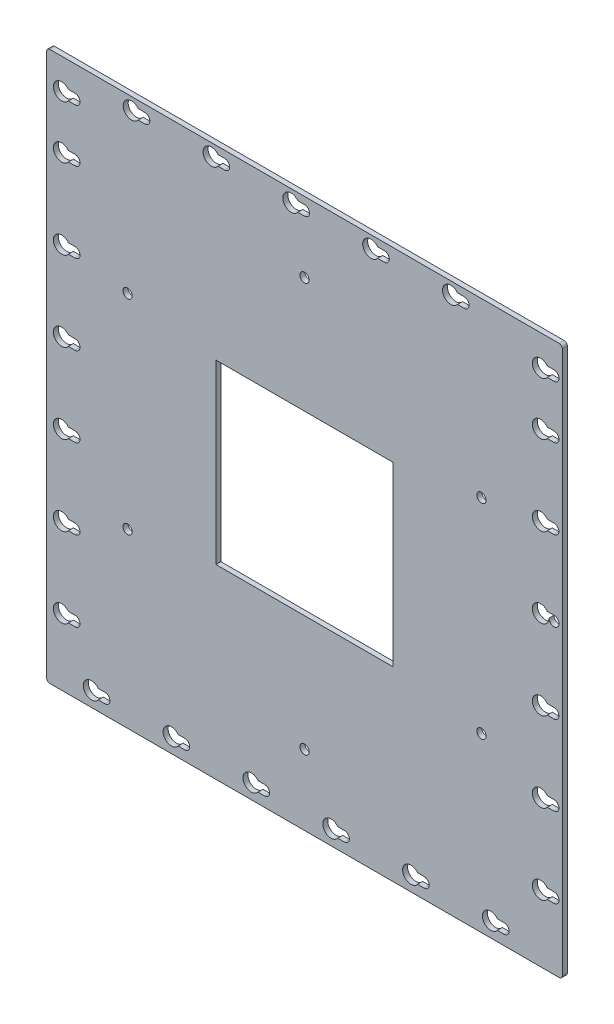
from build123d import *

# Parameters (mm, degrees)
SKETCH1_W           = 164.1
SKETCH1_H           = 174.745
SKETCH1_R           = 1.4732
SKETCH1_W_2         = 56.35
SKETCH1_H_2         = 56.35
BOSS_EXTRUDE1_DEPTH = 1.5875
FILLET1_R           = 1


with BuildPart() as part:
    # Sketch1 → Boss-Extrude1 (new body)
    with BuildSketch(Plane.XY):
        with Locations((82.55, -87.3725)):
            Rectangle(SKETCH1_W, SKETCH1_H)
        with Locations((82.55, -152.3725)):
            Circle(SKETCH1_R, mode=Mode.SUBTRACT)
        with Locations((82.55, -87.3725)):
            Rectangle(SKETCH1_W_2, SKETCH1_H_2, mode=Mode.SUBTRACT)
        with Locations((82.55, -22.3725)):
            Circle(SKETCH1_R, mode=Mode.SUBTRACT)
        with BuildLine():
            Line((82.55, -5.4375), (80.434372699, -5.4375))
            ThreePointArc((80.434372699, -5.4375), (75.6625, -3.85), (80.434372699, -2.2625))
            Line((80.434372699, -2.2625), (82.55, -2.2625))
            ThreePointArc((82.55, -2.2625), (84.1375, -3.85), (82.55, -5.4375))
        make_face(mode=Mode.SUBTRACT)
        with BuildLine():
            Line((16.934372699, -168.395), (19.05, -168.395))
            ThreePointArc((19.05, -168.395), (20.6375, -169.9825), (19.05, -171.57))
            Line((19.05, -171.57), (16.934372699, -171.57))
            ThreePointArc((16.934372699, -171.57), (12.1625, -169.9825), (16.934372699, -168.395))
        make_face(mode=Mode.SUBTRACT)
        with BuildLine():
            Line((7.409372699, -151.9325), (9.525, -151.9325))
            ThreePointArc((9.525, -151.9325), (11.1125, -153.52), (9.525, -155.1075))
            Line((9.525, -155.1075), (7.409372699, -155.1075))
            ThreePointArc((7.409372699, -155.1075), (2.6375, -153.52), (7.409372699, -151.9325))
        make_face(mode=Mode.SUBTRACT)
        with BuildLine():
            Line((42.334372699, -168.395), (44.45, -168.395))
            ThreePointArc((44.45, -168.395), (46.0375, -169.9825), (44.45, -171.57))
            Line((44.45, -171.57), (42.334372699, -171.57))
            ThreePointArc((42.334372699, -171.57), (37.5625, -169.9825), (42.334372699, -168.395))
        make_face(mode=Mode.SUBTRACT)
        with BuildLine():
            Line((67.734372699, -168.395), (69.85, -168.395))
            ThreePointArc((69.85, -168.395), (71.4375, -169.9825), (69.85, -171.57))
            Line((69.85, -171.57), (67.734372699, -171.57))
            ThreePointArc((67.734372699, -171.57), (62.9625, -169.9825), (67.734372699, -168.395))
        make_face(mode=Mode.SUBTRACT)
        with BuildLine():
            Line((7.409372699, -126.5325), (9.525, -126.5325))
            ThreePointArc((9.525, -126.5325), (11.1125, -128.12), (9.525, -129.7075))
            Line((9.525, -129.7075), (7.409372699, -129.7075))
            ThreePointArc((7.409372699, -129.7075), (2.6375, -128.12), (7.409372699, -126.5325))
        make_face(mode=Mode.SUBTRACT)
        with Locations((26.258348754, -119.8725)):
            Circle(SKETCH1_R, mode=Mode.SUBTRACT)
        with BuildLine():
            Line((7.409372699, -101.1325), (9.525, -101.1325))
            ThreePointArc((9.525, -101.1325), (11.1125, -102.72), (9.525, -104.3075))
            Line((9.525, -104.3075), (7.409372699, -104.3075))
            ThreePointArc((7.409372699, -104.3075), (2.6375, -102.72), (7.409372699, -101.1325))
        make_face(mode=Mode.SUBTRACT)
        with BuildLine():
            Line((7.409372699, -75.7325), (9.525, -75.7325))
            ThreePointArc((9.525, -75.7325), (11.1125, -77.32), (9.525, -78.9075))
            Line((9.525, -78.9075), (7.409372699, -78.9075))
            ThreePointArc((7.409372699, -78.9075), (2.6375, -77.32), (7.409372699, -75.7325))
        make_face(mode=Mode.SUBTRACT)
        with BuildLine():
            Line((7.409372699, -50.3325), (9.525, -50.3325))
            ThreePointArc((9.525, -50.3325), (11.1125, -51.92), (9.525, -53.5075))
            Line((9.525, -53.5075), (7.409372699, -53.5075))
            ThreePointArc((7.409372699, -53.5075), (2.6375, -51.92), (7.409372699, -50.3325))
        make_face(mode=Mode.SUBTRACT)
        with Locations((26.258348754, -54.8725)):
            Circle(SKETCH1_R, mode=Mode.SUBTRACT)
        with BuildLine():
            Line((7.409372699, -24.9325), (9.525, -24.9325))
            ThreePointArc((9.525, -24.9325), (11.1125, -26.52), (9.525, -28.1075))
            Line((9.525, -28.1075), (7.409372699, -28.1075))
            ThreePointArc((7.409372699, -28.1075), (2.6375, -26.52), (7.409372699, -24.9325))
        make_face(mode=Mode.SUBTRACT)
        with BuildLine():
            Line((7.409372699, -8.1), (9.525, -8.1))
            ThreePointArc((9.525, -8.1), (11.1125, -9.6875), (9.525, -11.275))
            Line((9.525, -11.275), (7.409372699, -11.275))
            ThreePointArc((7.409372699, -11.275), (2.6375, -9.6875), (7.409372699, -8.1))
        make_face(mode=Mode.SUBTRACT)
        with BuildLine():
            Line((29.634372699, -2.2625), (31.75, -2.2625))
            ThreePointArc((31.75, -2.2625), (33.3375, -3.85), (31.75, -5.4375))
            Line((31.75, -5.4375), (29.634372699, -5.4375))
            ThreePointArc((29.634372699, -5.4375), (24.8625, -3.85), (29.634372699, -2.2625))
        make_face(mode=Mode.SUBTRACT)
        with BuildLine():
            Line((55.034372699, -2.2625), (57.15, -2.2625))
            ThreePointArc((57.15, -2.2625), (58.7375, -3.85), (57.15, -5.4375))
            Line((57.15, -5.4375), (55.034372699, -5.4375))
            ThreePointArc((55.034372699, -5.4375), (50.2625, -3.85), (55.034372699, -2.2625))
        make_face(mode=Mode.SUBTRACT)
        with BuildLine():
            ThreePointArc((161.925, -8.1), (163.5125, -9.6875), (161.925, -11.275))
            Line((161.925, -11.275), (159.809372699, -11.275))
            ThreePointArc((159.809372699, -11.275), (155.0375, -9.6875), (159.809372699, -8.1))
            Line((159.809372699, -8.1), (161.925, -8.1))
        make_face(mode=Mode.SUBTRACT)
        with BuildLine():
            Line((93.134372699, -168.395), (95.25, -168.395))
            ThreePointArc((95.25, -168.395), (96.8375, -169.9825), (95.25, -171.57))
            Line((95.25, -171.57), (93.134372699, -171.57))
            ThreePointArc((93.134372699, -171.57), (88.3625, -169.9825), (93.134372699, -168.395))
        make_face(mode=Mode.SUBTRACT)
        with BuildLine():
            Line((118.534372699, -168.395), (120.65, -168.395))
            ThreePointArc((120.65, -168.395), (122.2375, -169.9825), (120.65, -171.57))
            Line((120.65, -171.57), (118.534372699, -171.57))
            ThreePointArc((118.534372699, -171.57), (113.7625, -169.9825), (118.534372699, -168.395))
        make_face(mode=Mode.SUBTRACT)
        with BuildLine():
            Line((143.934372699, -168.395), (146.05, -168.395))
            ThreePointArc((146.05, -168.395), (147.6375, -169.9825), (146.05, -171.57))
            Line((146.05, -171.57), (143.934372699, -171.57))
            ThreePointArc((143.934372699, -171.57), (139.1625, -169.9825), (143.934372699, -168.395))
        make_face(mode=Mode.SUBTRACT)
        with BuildLine():
            Line((159.809372699, -151.9325), (161.925, -151.9325))
            ThreePointArc((161.925, -151.9325), (163.5125, -153.52), (161.925, -155.1075))
            Line((161.925, -155.1075), (159.809372699, -155.1075))
            ThreePointArc((159.809372699, -155.1075), (155.0375, -153.52), (159.809372699, -151.9325))
        make_face(mode=Mode.SUBTRACT)
        with Locations((138.841651246, -119.8725)):
            Circle(SKETCH1_R, mode=Mode.SUBTRACT)
        with BuildLine():
            Line((159.809372699, -126.5325), (161.925, -126.5325))
            ThreePointArc((161.925, -126.5325), (163.5125, -128.12), (161.925, -129.7075))
            Line((161.925, -129.7075), (159.809372699, -129.7075))
            ThreePointArc((159.809372699, -129.7075), (155.0375, -128.12), (159.809372699, -126.5325))
        make_face(mode=Mode.SUBTRACT)
        with BuildLine():
            Line((159.809372699, -101.1325), (161.925, -101.1325))
            ThreePointArc((161.925, -101.1325), (163.5125, -102.72), (161.925, -104.3075))
            Line((161.925, -104.3075), (159.809372699, -104.3075))
            ThreePointArc((159.809372699, -104.3075), (155.0375, -102.72), (159.809372699, -101.1325))
        make_face(mode=Mode.SUBTRACT)
        with BuildLine():
            Line((159.809372699, -75.7325), (161.925, -75.7325))
            ThreePointArc((161.925, -75.7325), (163.047532015, -78.442532015), (160.3375, -77.32))
            ThreePointArc((160.3375, -77.32), (155.172995809, -78.156521771), (159.809372699, -75.7325))
        make_face(mode=Mode.SUBTRACT)
        with Locations((138.841651246, -54.8725)):
            Circle(SKETCH1_R, mode=Mode.SUBTRACT)
        with BuildLine():
            Line((159.809372699, -50.3325), (161.925, -50.3325))
            ThreePointArc((161.925, -50.3325), (163.5125, -51.92), (161.925, -53.5075))
            Line((161.925, -53.5075), (159.809372699, -53.5075))
            ThreePointArc((159.809372699, -53.5075), (155.0375, -51.92), (159.809372699, -50.3325))
        make_face(mode=Mode.SUBTRACT)
        with BuildLine():
            Line((105.834372699, -2.2625), (107.95, -2.2625))
            ThreePointArc((107.95, -2.2625), (109.5375, -3.85), (107.95, -5.4375))
            Line((107.95, -5.4375), (105.834372699, -5.4375))
            ThreePointArc((105.834372699, -5.4375), (101.0625, -3.85), (105.834372699, -2.2625))
        make_face(mode=Mode.SUBTRACT)
        with BuildLine():
            Line((159.809372699, -24.9325), (161.925, -24.9325))
            ThreePointArc((161.925, -24.9325), (163.5125, -26.52), (161.925, -28.1075))
            Line((161.925, -28.1075), (159.809372699, -28.1075))
            ThreePointArc((159.809372699, -28.1075), (155.0375, -26.52), (159.809372699, -24.9325))
        make_face(mode=Mode.SUBTRACT)
        with BuildLine():
            Line((131.234372699, -2.2625), (133.35, -2.2625))
            ThreePointArc((133.35, -2.2625), (134.9375, -3.85), (133.35, -5.4375))
            Line((133.35, -5.4375), (131.234372699, -5.4375))
            ThreePointArc((131.234372699, -5.4375), (126.4625, -3.85), (131.234372699, -2.2625))
        make_face(mode=Mode.SUBTRACT)
    extrude(amount=BOSS_EXTRUDE1_DEPTH)

    # Fillet1
    fillet1_edges = [part.edges().sort_by_distance(p)[0] for p in [
        (0.5, -174.745, 0.79375),
        (0.5, 0, 0.79375),
        (164.6, 0, 0.79375),
        (164.6, -174.745, 0.79375),
    ]]
    fillet(fillet1_edges, radius=FILLET1_R)


solid = part.part
